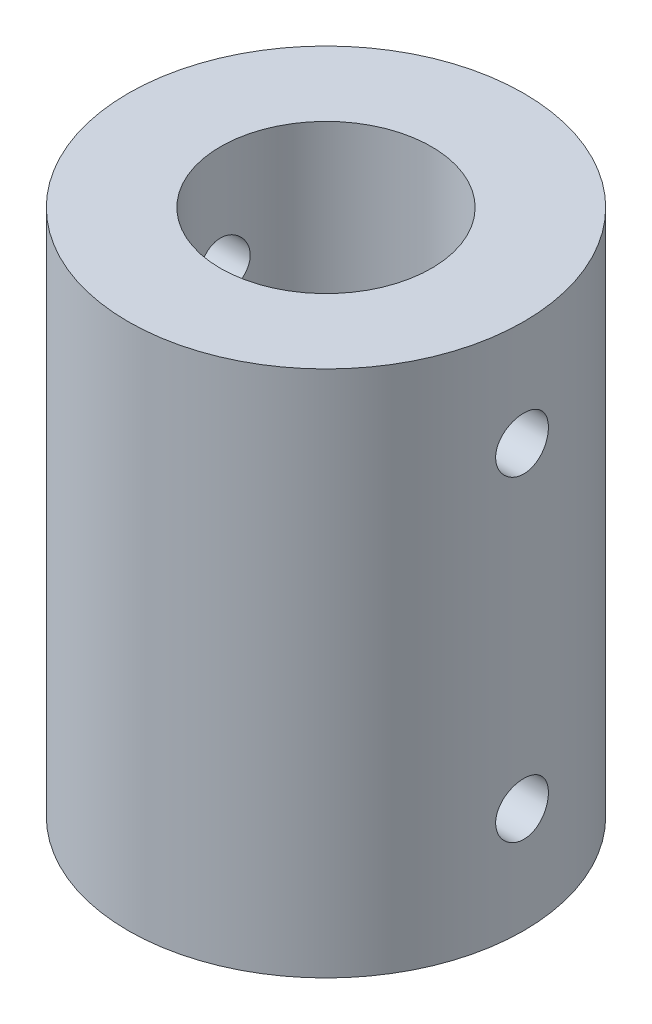
from build123d import *

# Parameters (mm, degrees)
SKETCH1_R               = 7.5
SKETCH1_R_2             = 4
BOSS_EXTRUDE2_DEPTH     = 10
BOSS_EXTRUDE3_START     = -10
SKETCH1_3_R             = 7.5
SKETCH1_3_R_2           = 2.5
BOSS_EXTRUDE3_DEPTH     = 10
CUT_EXTRUDE1_DEPTH      = 15.577379737
CUT_EXTRUDE1_DEPTH_BACK = 15.577379737
SKETCH2_R               = 1


with BuildPart() as part:
    # Sketch1 → Boss-Extrude2 (new body)
    with BuildSketch(Plane(origin=(0, 0, 0), x_dir=(1, 0, 0), z_dir=(0, 1, 0))):
        Circle(SKETCH1_R)
        Circle(SKETCH1_R_2, mode=Mode.SUBTRACT)
    extrude(amount=BOSS_EXTRUDE2_DEPTH)

    # Sketch1<3> → Boss-Extrude3 (add)
    with BuildSketch(Plane(origin=(0, 0, 0), x_dir=(1, 0, 0), z_dir=(0, 1, 0)).offset(BOSS_EXTRUDE3_START)):
        Circle(SKETCH1_3_R)
        Circle(SKETCH1_3_R_2, mode=Mode.SUBTRACT)
    extrude(amount=BOSS_EXTRUDE3_DEPTH)

    # Sketch2 → Cut-Extrude1 (cut, two sides: drawn at the far end of the back side and taken through both)
    with BuildSketch(Plane(origin=(0, 0, 0), x_dir=(0, 0, -1), z_dir=(1, 0, 0)).offset(-CUT_EXTRUDE1_DEPTH_BACK)):
        with Locations((0, 6)):
            Circle(SKETCH2_R)
        with Locations((0, -6)):
            Circle(SKETCH2_R)
    extrude(amount=CUT_EXTRUDE1_DEPTH + CUT_EXTRUDE1_DEPTH_BACK, mode=Mode.SUBTRACT)


solid = part.part
